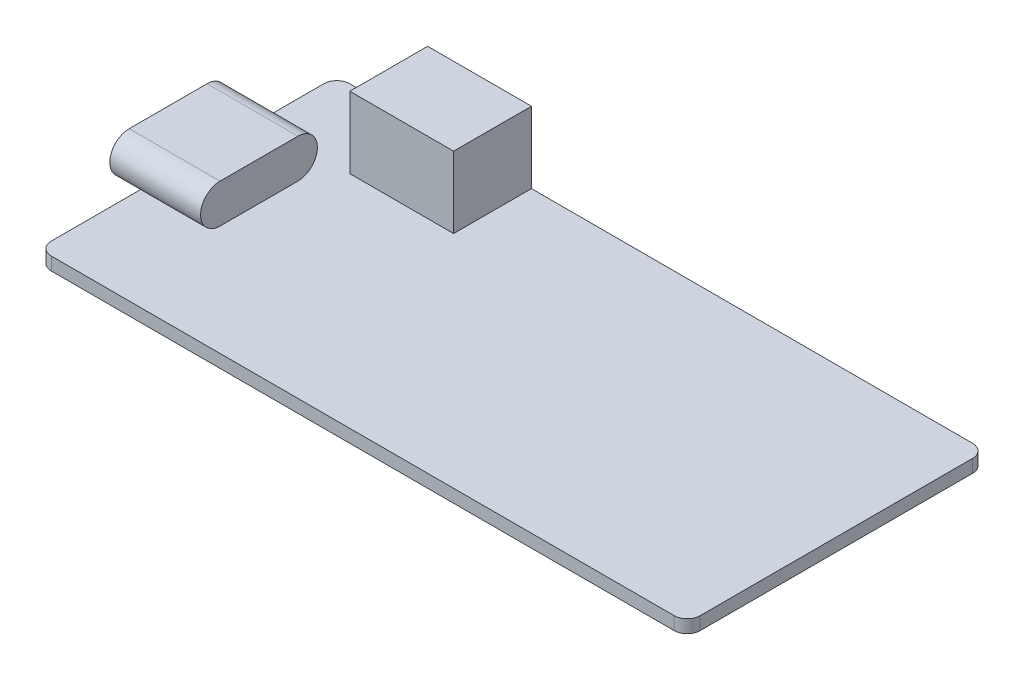
from build123d import *

# Parameters (mm, degrees)
SKETCH1_W                = 50
SKETCH1_H                = 23
BOSS_EXTRUDE1_DEPTH      = 1
FILLET1_R                = 1
BOSS_EXTRUDE2_DEPTH      = 1.5
BOSS_EXTRUDE2_DEPTH_BACK = 5.5
SKETCH3_W                = 8
SKETCH3_H                = 6
BOSS_EXTRUDE3_DEPTH      = 5.5


with BuildPart() as part:
    # Sketch1 → Boss-Extrude1 (new body)
    with BuildSketch(Plane(origin=(0, 0, 0), x_dir=(1, 0, 0), z_dir=(0, 1, 0))):
        with Locations((25, 11.5)):
            Rectangle(SKETCH1_W, SKETCH1_H)
    extrude(amount=BOSS_EXTRUDE1_DEPTH)

    # Fillet1
    fillet1_edges = [part.edges().sort_by_distance(p)[0] for p in [
        (0, 0.5, -23),
        (50, 0.5, -23),
        (50, 0.5, 0),
        (0, 0.5, 0),
    ]]
    fillet(fillet1_edges, radius=FILLET1_R)

    # Sketch2 → Boss-Extrude2 (add, two sides: drawn at the far end of the back side and taken through both)
    with BuildSketch(Plane.ZY.offset(-BOSS_EXTRUDE2_DEPTH_BACK)):
        with BuildLine():
            Line((-8.5, 1), (-14.5, 1))
            ThreePointArc((-14.5, 1), (-16, 2.5), (-14.5, 4))
            Line((-14.5, 4), (-8.5, 4))
            ThreePointArc((-8.5, 4), (-7, 2.5), (-8.5, 1))
        make_face()
    extrude(amount=BOSS_EXTRUDE2_DEPTH + BOSS_EXTRUDE2_DEPTH_BACK)

    # Sketch3 → Boss-Extrude3 (add)
    with BuildSketch(Plane(origin=(0, 1, 0), x_dir=(1, 0, 0), z_dir=(0, 1, 0))):
        with Locations((11, 20)):
            Rectangle(SKETCH3_W, SKETCH3_H)
    extrude(amount=BOSS_EXTRUDE3_DEPTH)


solid = part.part
